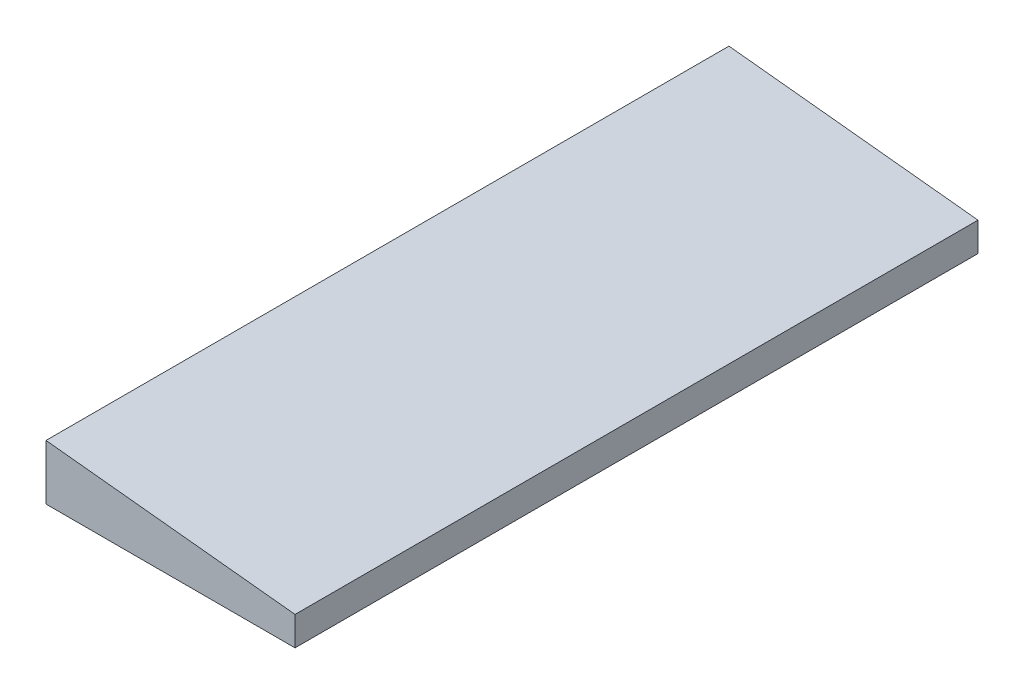
from build123d import *

# Parameters (mm, degrees)
BOSS_EXTRUDE1_DEPTH = 165


with BuildPart() as part:
    # Sketch1 → Boss-Extrude1 (new, symmetric)
    with BuildSketch(Plane.XY):
        Polygon((0, 0), (120.33714934, 0), (120.33714934, 14), (0, 26.647944055), align=None)
    extrude(amount=BOSS_EXTRUDE1_DEPTH, both=True)


solid = part.part
